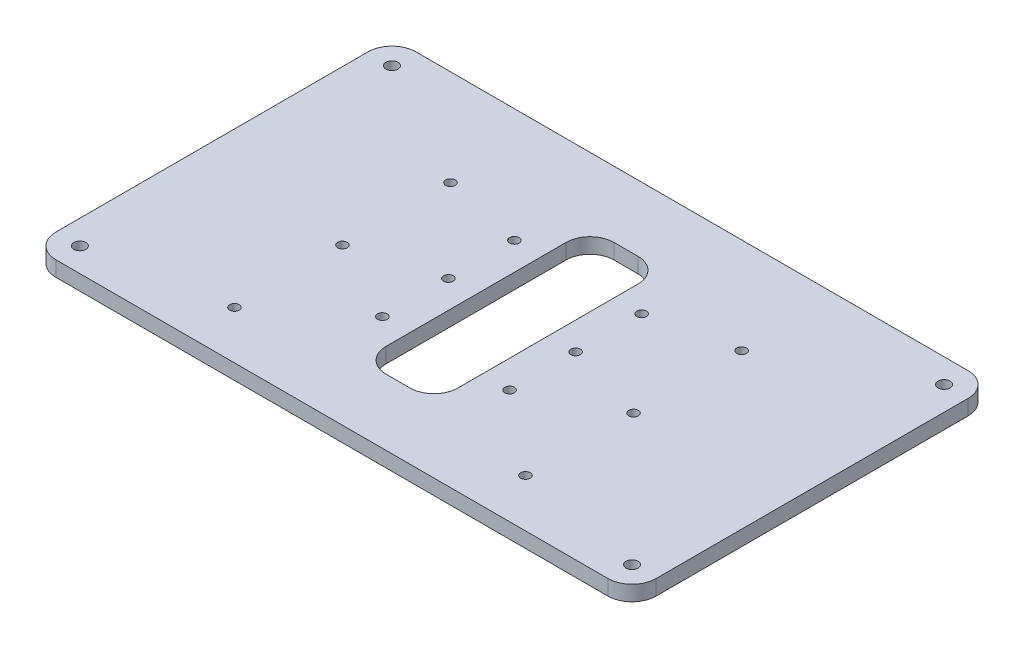
from build123d import *

# Parameters (mm, degrees)
SKETCH1_W           = 250
SKETCH1_H           = 150
BOSS_EXTRUDE1_DEPTH = 6.35
SKETCH2_R           = 2.5
SKETCH2_W           = 30
SKETCH2_H           = 95
CUT_EXTRUDE1_DEPTH  = 146.912036858
FILLET1_R           = 10
SKETCH3_R           = 2
CUT_EXTRUDE2_DEPTH  = 146.912036858


with BuildPart() as part:
    # Sketch1 → Boss-Extrude1 (new body)
    with BuildSketch(Plane(origin=(0, 0, 0), x_dir=(1, 0, 0), z_dir=(0, 1, 0))):
        Rectangle(SKETCH1_W, SKETCH1_H)
    extrude(amount=BOSS_EXTRUDE1_DEPTH)

    # Sketch2 → Cut-Extrude1 (cut, through all)
    with BuildSketch(Plane(origin=(0, 6.35, 0), x_dir=(1, 0, 0), z_dir=(0, 1, 0))):
        with Locations(Location((-115, 65, 0), (0, 0, 270))):
            Circle(SKETCH2_R)
        with Locations(Location((115, 65, 0), (0, 0, 270))):
            Circle(SKETCH2_R)
        with Locations(Location((115, -65, 0), (0, 0, 270))):
            Circle(SKETCH2_R)
        with Locations(Location((-115, -65, 0), (0, 0, 270))):
            Circle(SKETCH2_R)
        Rectangle(SKETCH2_W, SKETCH2_H)
    extrude(amount=-CUT_EXTRUDE1_DEPTH, mode=Mode.SUBTRACT)

    # Fillet1
    fillet1_edges = [part.edges().sort_by_distance(p)[0] for p in [
        (-15, 3.175, 47.5),
        (-15, 3.175, -47.5),
        (15, 3.175, -47.5),
        (15, 3.175, 47.5),
        (-125, 3.175, -75),
        (125, 3.175, -75),
        (125, 3.175, 75),
        (-125, 3.175, 75),
    ]]
    fillet(fillet1_edges, radius=FILLET1_R)

    # Sketch3 → Cut-Extrude2 (cut, through all)
    with BuildSketch(Plane(origin=(0, 6.35, 0), x_dir=(1, 0, 0), z_dir=(0, 1, 0))):
        with Locations(Location((-60.62, 35, 0), (0, 0, 270))):
            Circle(SKETCH3_R)
        with Locations(Location((-60.62, -10, 0), (0, 0, 270))):
            Circle(SKETCH3_R)
        with Locations(Location((-60.62, -55, 0), (0, 0, 270))):
            Circle(SKETCH3_R)
        with Locations(Location((60.62, 35, 0), (0, 0, 270))):
            Circle(SKETCH3_R)
        with Locations(Location((60.62, -10, 0), (0, 0, 270))):
            Circle(SKETCH3_R)
        with Locations(Location((60.62, -55, 0), (0, 0, 270))):
            Circle(SKETCH3_R)
        with Locations(Location((-26.5, 27.5, 0), (0, 0, 270))):
            Circle(SKETCH3_R)
        with Locations(Location((-26.5, -27.5, 0), (0, 0, 270))):
            Circle(SKETCH3_R)
        with Locations(Location((26.5, -27.5, 0), (0, 0, 270))):
            Circle(SKETCH3_R)
        with Locations(Location((26.5, 27.5, 0), (0, 0, 270))):
            Circle(SKETCH3_R)
        with Locations(Location((-26.5, 0, 0), (0, 0, 270))):
            Circle(SKETCH3_R)
        with Locations(Location((26.5, 0, 0), (0, 0, 270))):
            Circle(SKETCH3_R)
    extrude(amount=-CUT_EXTRUDE2_DEPTH, mode=Mode.SUBTRACT)


solid = part.part
